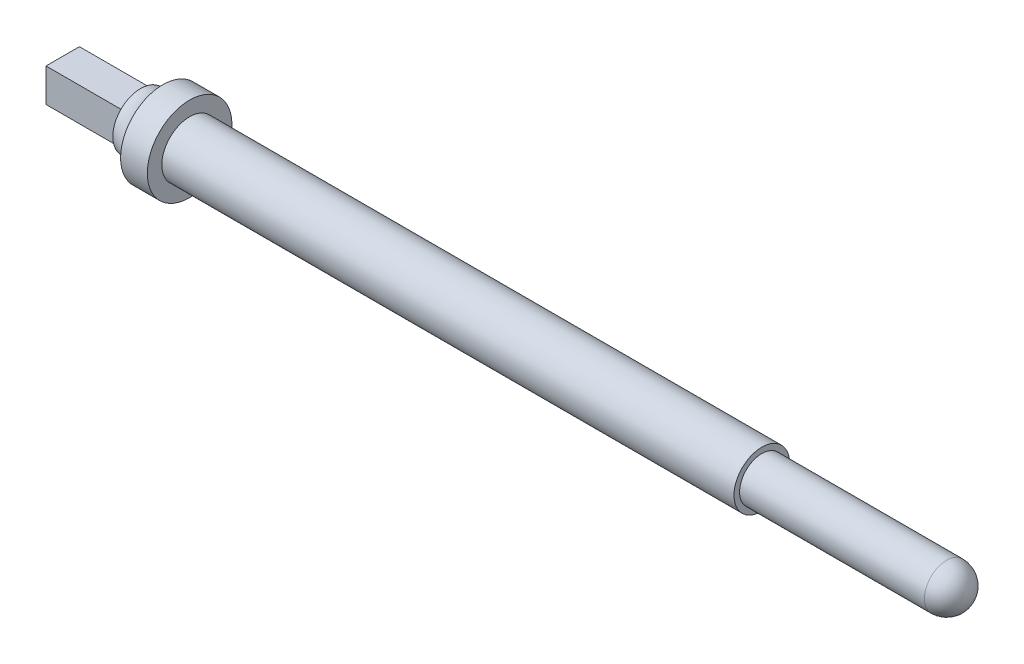
from build123d import *

# Parameters (mm, degrees)
SKETCH2_W           = 15
SKETCH2_H           = 15
BOSS_EXTRUDE1_DEPTH = 35


with BuildPart() as part:
    # Sketch1 → Revolve1 (revolve)
    with BuildSketch(Plane.XY, mode=Mode.PRIVATE) as revolve1_sk:
        with BuildLine():
            Line((0, 19), (12, 19))
            Line((12, 19), (12, 12.5))
            Line((12, 12.5), (269, 12.5))
            Line((269, 12.5), (269, 10))
            Line((269, 10), (352, 10))
            ThreePointArc((352, 10), (359.071067812, 7.071067812), (362, 0))
            Line((362, 0), (-10, 0))
            Line((-10, 0), (-10, 12.5))
            ThreePointArc((-10, 12.5), (-4.143637104, 14.432518621), (0, 19))
        make_face()
    revolve(revolve1_sk.sketch.rotate(Axis((-14.332813636, 0, 0), (1, 0, 0)), 180), axis=Axis((-14.332813636, 0, 0), (1, 0, 0)))

    # Sketch2 → Boss-Extrude1 (add)
    with BuildSketch(Plane.ZY.offset(10)):
        Rectangle(SKETCH2_W, SKETCH2_H)
    extrude(amount=BOSS_EXTRUDE1_DEPTH)


solid = part.part
